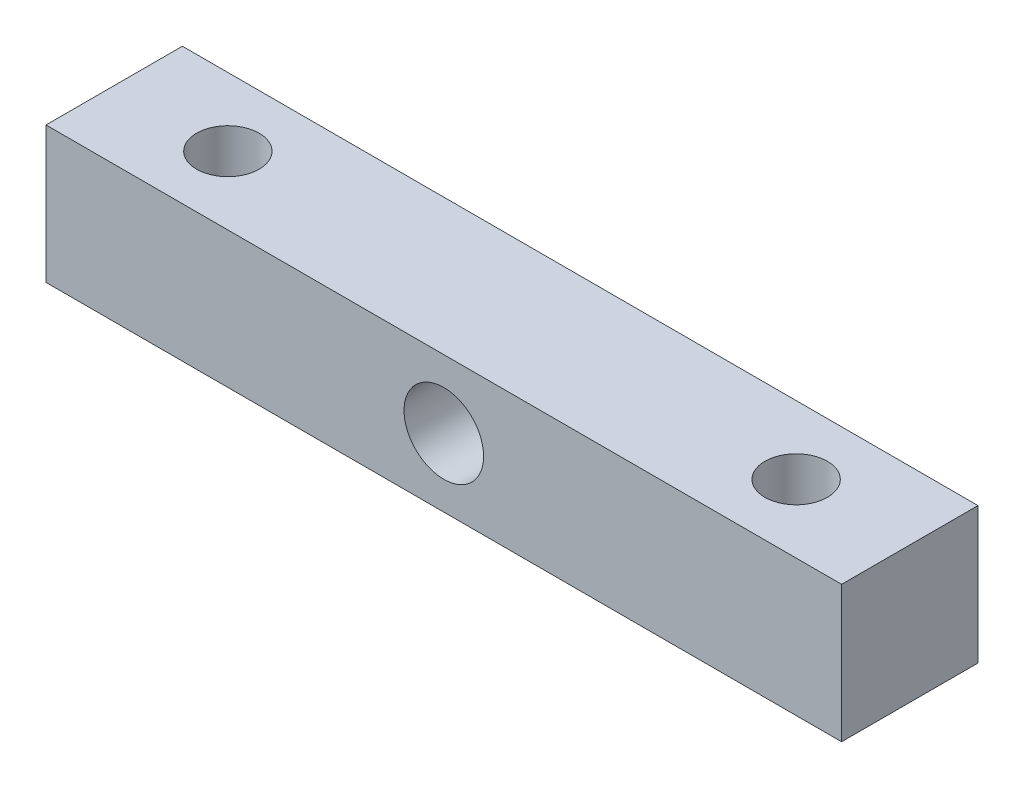
from build123d import *

# Parameters (mm, degrees)
SKETCH1_W                  = 70
SKETCH1_H                  = 12
BOSS_EXTRUDE1_DEPTH        = 12
M8X1_0_TAPPED_HOLE1_D      = 7
F_5_5_5_5_DIAMETER_HOLE1_D = 5.5


with BuildPart() as part:
    # Sketch1 → Boss-Extrude1 (new body)
    with BuildSketch(Plane(origin=(0, 0, 0), x_dir=(1, 0, 0), z_dir=(0, 1, 0))):
        with Locations((35, 6)):
            Rectangle(SKETCH1_W, SKETCH1_H)
    extrude(amount=BOSS_EXTRUDE1_DEPTH)

    # M8x1.0 Tapped Hole1 (through all)
    with Locations(Plane.XY):
        with Locations((35, 6)):
            Hole(M8X1_0_TAPPED_HOLE1_D / 2)

    # Ø5.5 (5.5) Diameter Hole1 (through all)
    with Locations(Plane(origin=(0, 12, 0), x_dir=(-1, 0, 0), z_dir=(0, 1, 0))):
        with Locations((-10, -6), (-60, -6)):
            Hole(F_5_5_5_5_DIAMETER_HOLE1_D / 2)


solid = part.part
